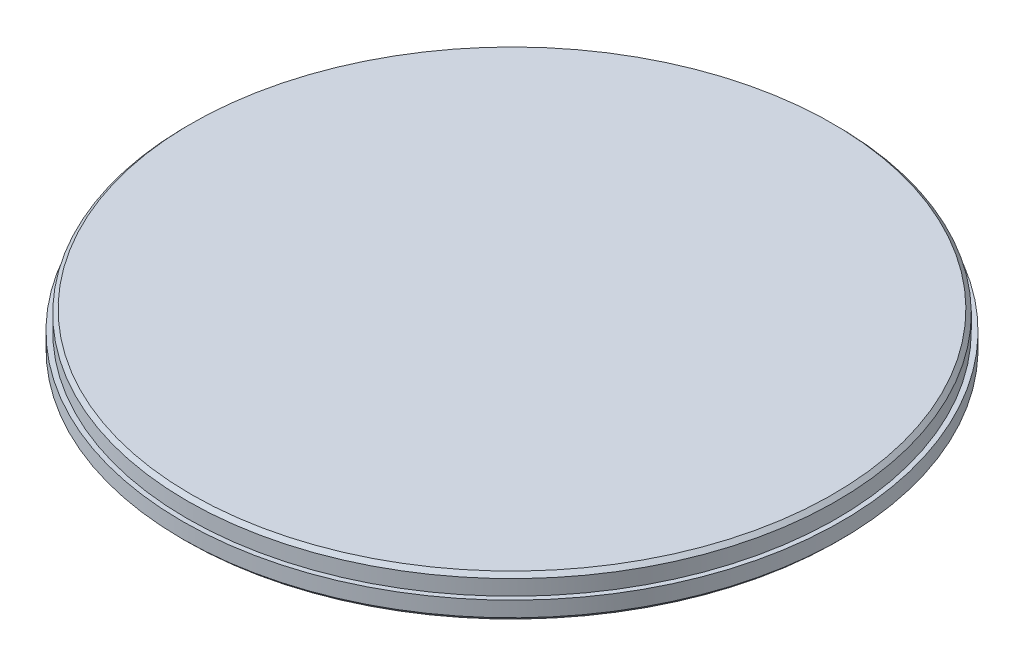
from build123d import *

# Parameters (mm, degrees)
SKETCH1_R           = 17.25
BOSS_EXTRUDE1_DEPTH = 2
SKETCH2_OUTSIDE_W   = 46.266
SKETCH2_OUTSIDE_H   = 46.266
SKETCH2_OUTSIDE_R   = 17
CUT_EXTRUDE1_DEPTH  = 1
CHAMFER1_SIZE       = 0.2


with BuildPart() as part:
    # Sketch1 → Boss-Extrude1 (new body)
    with BuildSketch(Plane(origin=(0, 0, 0), x_dir=(1, 0, 0), z_dir=(0, 1, 0))):
        with Locations(Location((0, 0, 0), (0, 0, 270))):
            Circle(SKETCH1_R)
    extrude(amount=BOSS_EXTRUDE1_DEPTH)

    # Sketch2 outside → Cut-Extrude1 (cut)
    with BuildSketch(Plane(origin=(0, 2, 0), x_dir=(1, 0, 0), z_dir=(0, 1, 0))):
        Rectangle(SKETCH2_OUTSIDE_W, SKETCH2_OUTSIDE_H)
        with Locations(Location((0, 0, 0), (0, 0, 270))):
            Circle(SKETCH2_OUTSIDE_R, mode=Mode.SUBTRACT)
    extrude(amount=-CUT_EXTRUDE1_DEPTH, mode=Mode.SUBTRACT)

    # Chamfer1
    chamfer1_edges = [part.edges().sort_by_distance(p)[0] for p in [
        (0, 2, -17),
        (0, 0, -17.25),
    ]]
    chamfer(chamfer1_edges, length=CHAMFER1_SIZE)


solid = part.part
